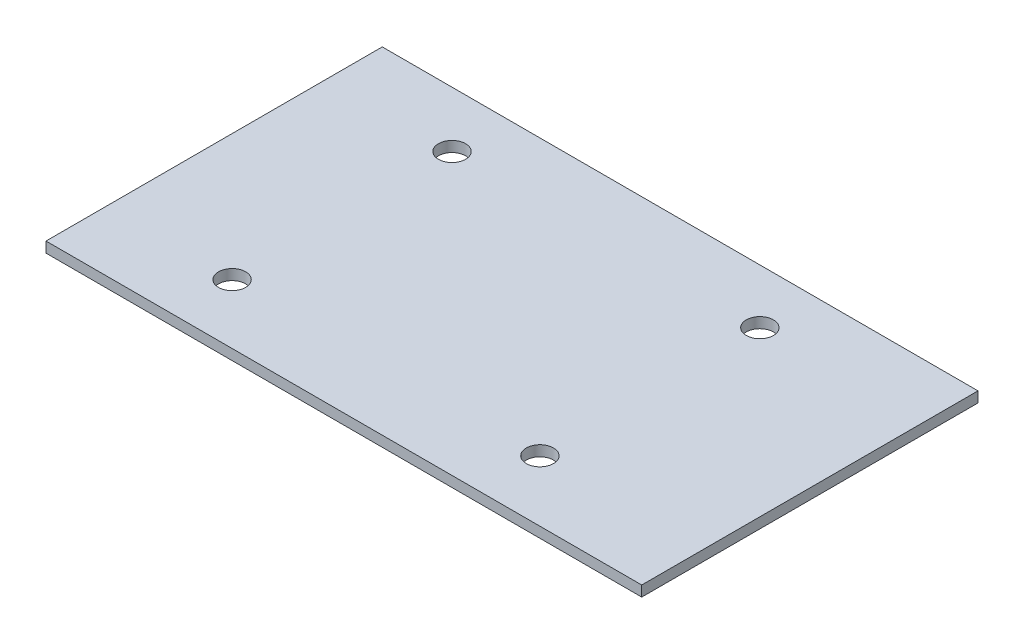
from build123d import *

# Parameters (mm, degrees)
SKETCH1_W           = 180
SKETCH1_H           = 101.6
SKETCH1_R           = 4.1
BOSS_EXTRUDE1_DEPTH = 3.175


with BuildPart() as part:
    # Sketch1 → Boss-Extrude1 (new body)
    with BuildSketch(Plane(origin=(0, 0, 0), x_dir=(1, 0, 0), z_dir=(0, 1, 0))):
        Rectangle(SKETCH1_W, SKETCH1_H)
        with Locations(Location((-52.086616081, 33.968888188, 0), (0, 0, 270))):
            Circle(SKETCH1_R, mode=Mode.SUBTRACT)
        with Locations(Location((40.5125, 34.373488098, 0), (0, 0, 270))):
            Circle(SKETCH1_R, mode=Mode.SUBTRACT)
        with Locations(Location((40.804139531, -32.37285096, 0), (0, 0, 270))):
            Circle(SKETCH1_R, mode=Mode.SUBTRACT)
        with Locations(Location((-51.79497655, -32.777450869, 0), (0, 0, 270))):
            Circle(SKETCH1_R, mode=Mode.SUBTRACT)
    extrude(amount=BOSS_EXTRUDE1_DEPTH)


solid = part.part
